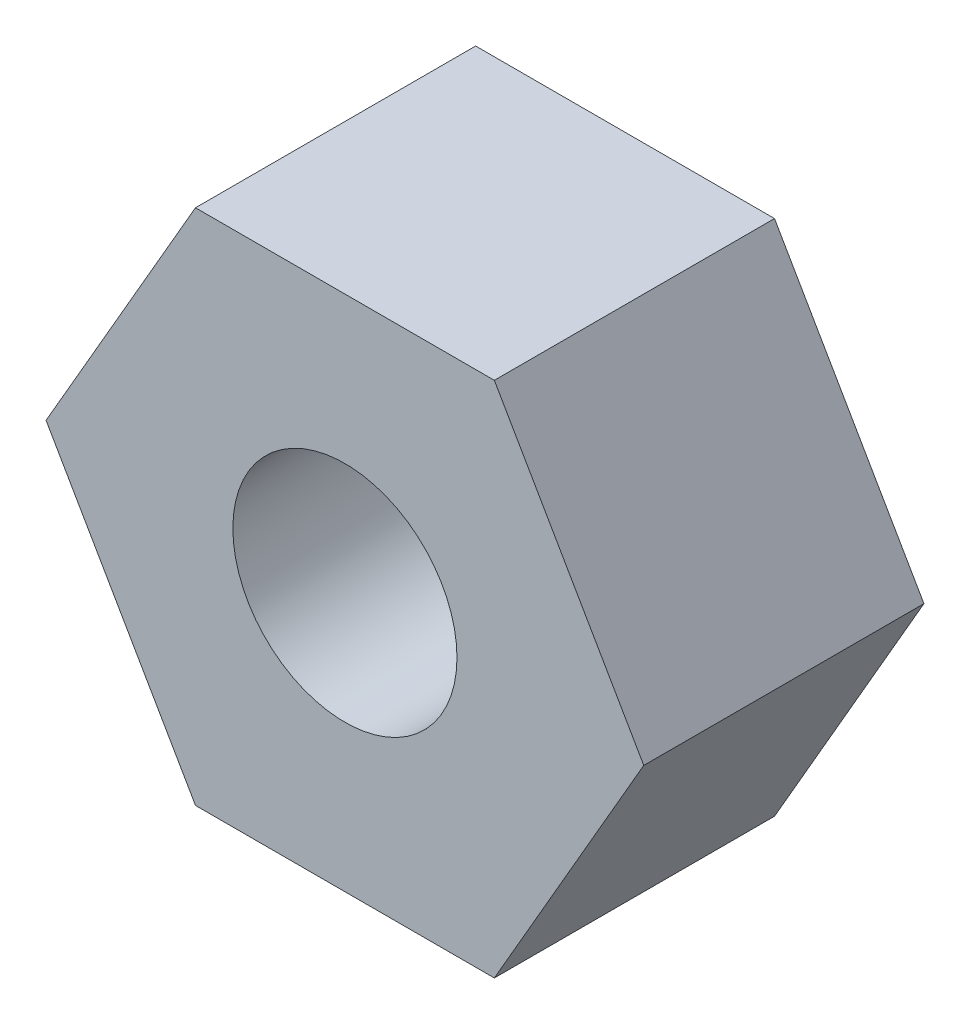
from build123d import *

# Parameters (mm, degrees)
EXTRUDE_1_DEPTH     = 3
SKETCH_2_R          = 1.2
CUT_EXTRUDE_1_DEPTH = 3


with BuildPart() as part:
    # 草图1 → 凸台-拉伸1 (new body)
    with BuildSketch(Plane.XY):
        Polygon((1.6, 2.771281292), (-1.6, 2.771281292), (-3.2, 0), (-1.6, -2.771281292), (1.6, -2.771281292), (3.2, 0), align=None)
    extrude(amount=EXTRUDE_1_DEPTH)

    # 草图2 → 切除-拉伸1 (cut)
    with BuildSketch(Plane(origin=(0, 0, 0), x_dir=(-1, 0, 0), z_dir=(0, 0, -1))):
        Circle(SKETCH_2_R)
    extrude(amount=-CUT_EXTRUDE_1_DEPTH, mode=Mode.SUBTRACT)


solid = part.part
